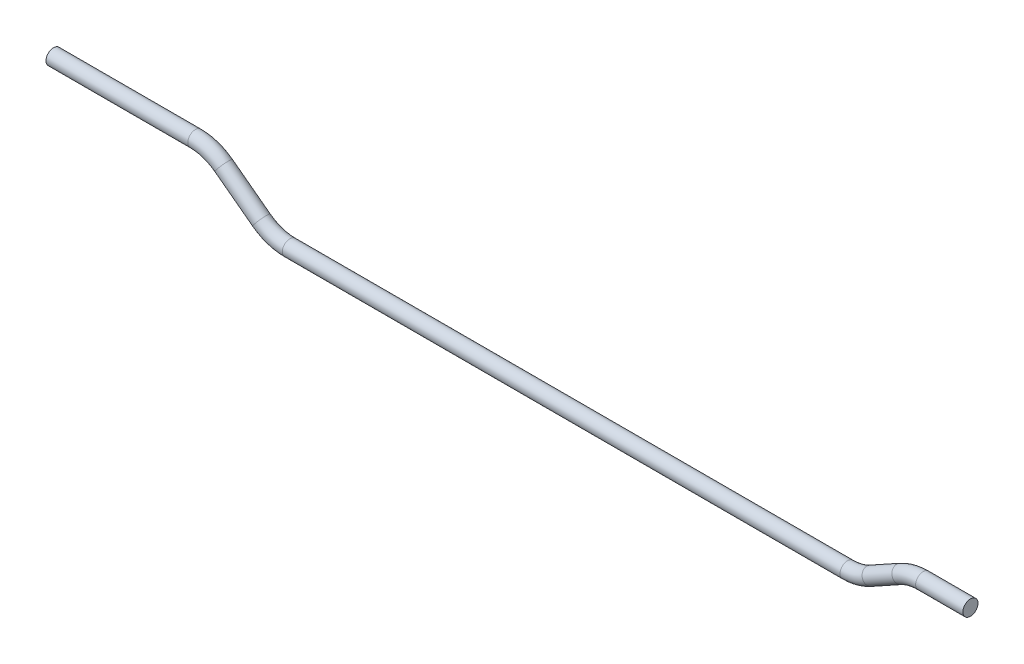
from build123d import *

# Parameters (mm, degrees)
SKETCH1_R = 0.8


with BuildPart() as part:
    # Sweep1: sweep along a path in Sketch2
    with BuildLine(Plane.XY) as sweep1_path:
        Line((0, 0), (15, 0))
        ThreePointArc((15, 0), (16.58113883, -0.25658351), (18, -1))
        Line((18, -1), (22, -4))
        ThreePointArc((22, -4), (23.41886117, -4.74341649), (25, -5))
        Line((25, -5), (84, -5))
        ThreePointArc((84, -5), (85.251352799, -4.84087969), (86.423059339, -4.373646469))
        Line((86.423059339, -4.373646469), (89.576940661, -2.626353531))
        ThreePointArc((89.576940661, -2.626353531), (90.748647201, -2.15912031), (92, -2))
        Line((92, -2), (97, -2))
    # Sketch1 → Sweep1 (sweep)
    with BuildSketch(Plane(origin=(0, 0, 0), x_dir=(0, 0, -1), z_dir=(1, 0, 0))):
        Circle(SKETCH1_R)
    sweep(path=sweep1_path.line)


solid = part.part
